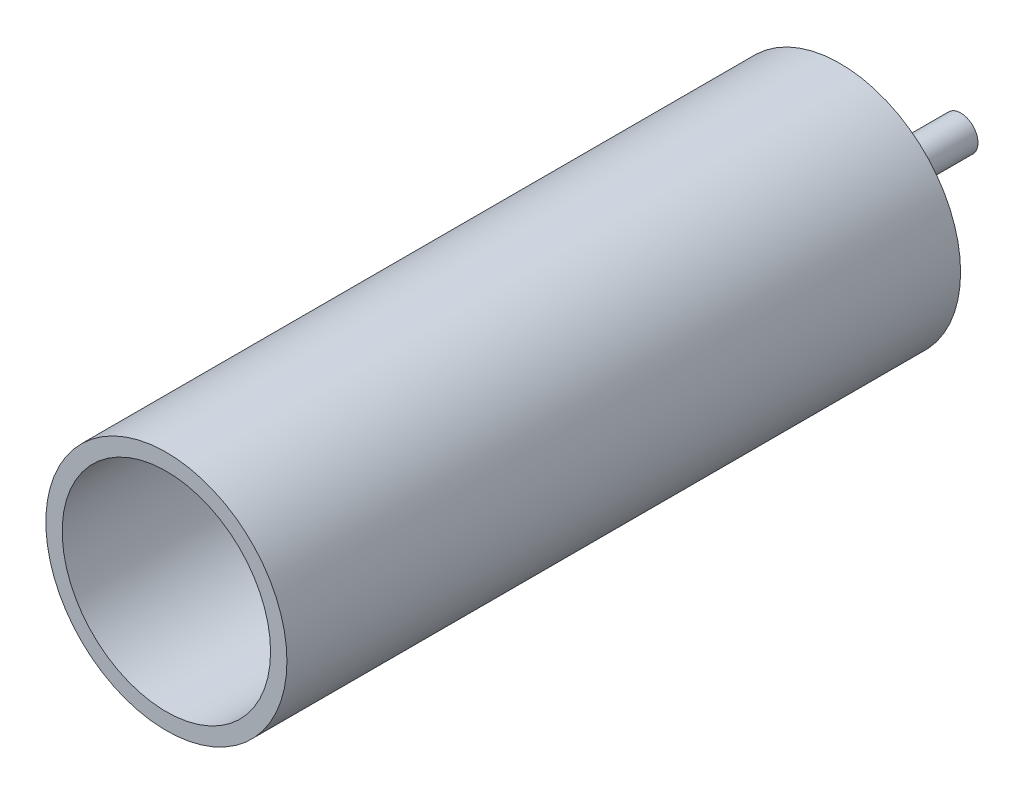
from build123d import *

# Parameters (mm, degrees)
SKETCH1_R           = 35
BOSS_EXTRUDE1_DEPTH = 195.58
SKETCH2_R           = 5
BOSS_EXTRUDE2_DEPTH = 35.052
SKETCH5_R           = 30.25
CUT_EXTRUDE1_DEPTH  = 152.4


with BuildPart() as part:
    # Sketch1 → Boss-Extrude1 (new body)
    with BuildSketch(Plane.XY):
        Circle(SKETCH1_R)
    extrude(amount=-BOSS_EXTRUDE1_DEPTH)

    # Sketch2 → Boss-Extrude2 (add)
    with BuildSketch(Plane(origin=(0, 0, -195.58), x_dir=(-1, 0, 0), z_dir=(0, 0, -1))):
        with Locations(Location((0, 0, 0), (0, 0, 180))):
            Circle(SKETCH2_R)
    extrude(amount=BOSS_EXTRUDE2_DEPTH)

    # Sketch5 → Cut-Extrude1 (cut)
    with BuildSketch(Plane.XY):
        Circle(SKETCH5_R)
    extrude(amount=-CUT_EXTRUDE1_DEPTH, mode=Mode.SUBTRACT)


solid = part.part
